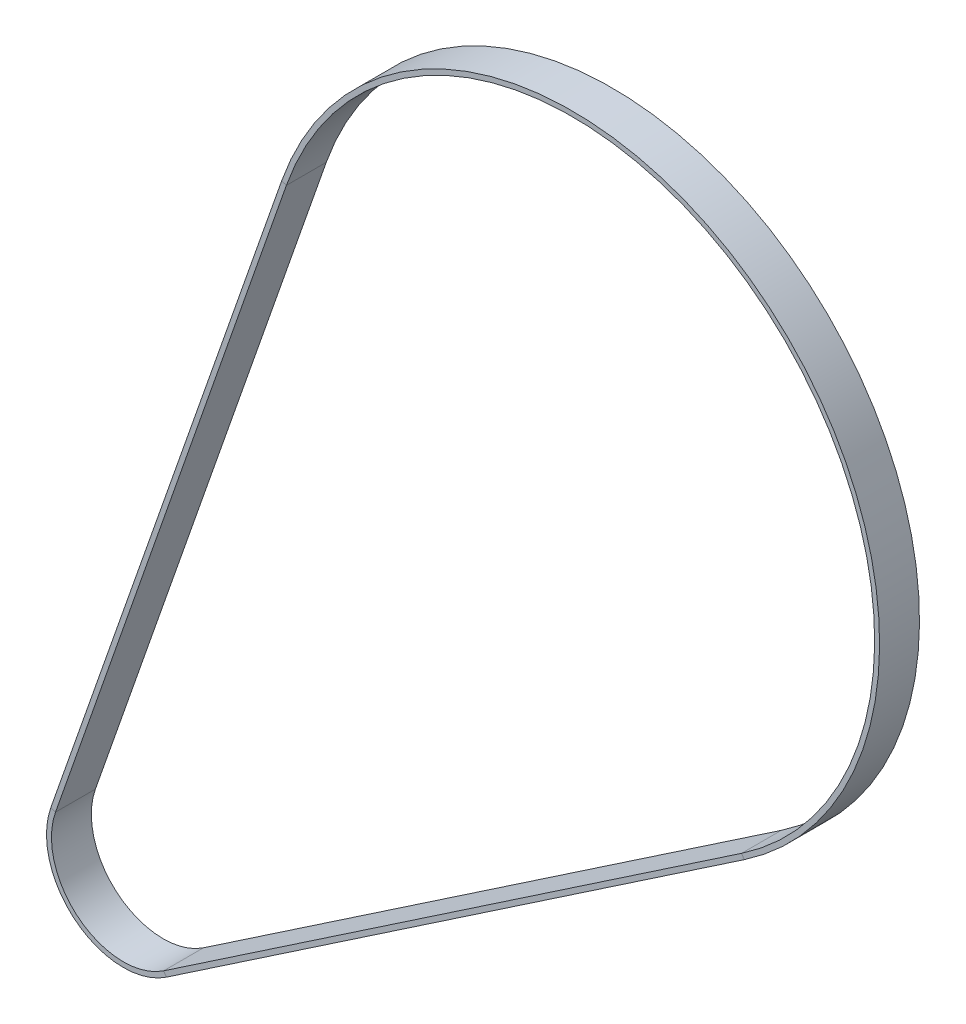
from build123d import *

# Parameters (mm, degrees)
SKETCH3_W = 0.5
SKETCH3_H = 4.023685774


with BuildPart() as part:
    # Sweep1: sweep along a path in Sketch2
    with BuildLine(Plane.XY) as sweep1_path:
        Line((17.248457562, -25.513240356), (-41.061386137, -64.934139089))
        ThreePointArc((-41.061386137, -64.934139089), (-49.855173636, -64.659892632), (-52.356779208, -56.224972402))
        Line((-52.356779208, -56.224972402), (-29.060923767, 10.19300896))
        ThreePointArc((-29.060923767, 10.19300896), (18.804724128, 24.388871895), (17.248457562, -25.513240356))
    # Sketch3 → Sweep1 (sweep)
    with BuildSketch(Plane(origin=(-52.356779208, -56.224972402, 0), x_dir=(0.9436385894180152, -0.3309776617253475, 0), z_dir=(0.3309776617253475, 0.9436385894180152, 0))):
        with Locations((0.006833178, 0)):
            Rectangle(SKETCH3_W, SKETCH3_H)
    sweep(path=sweep1_path.line)


solid = part.part
